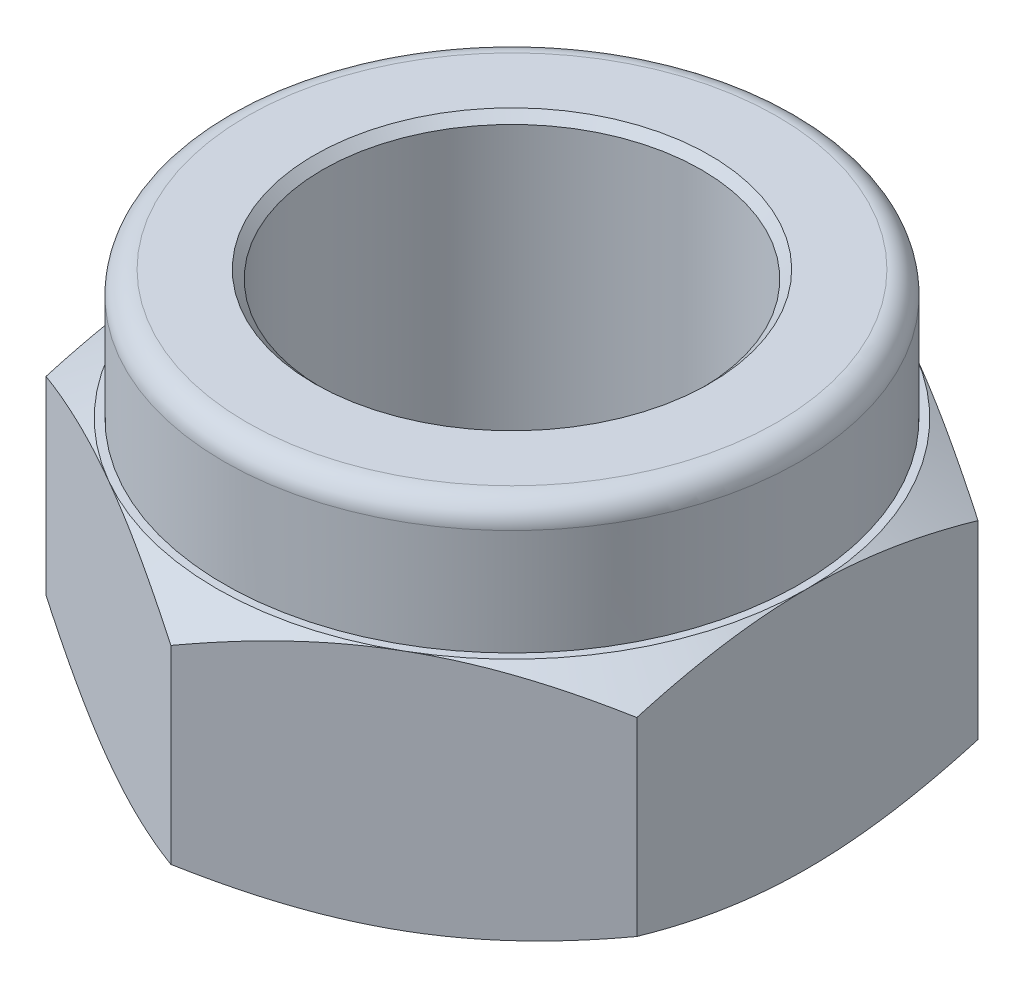
from build123d import *

# Parameters (mm, degrees)
EXTRUDE_START        = -3.2
EXTRUDE_1_DEPTH      = 3.2
SKETCH_2_3_OUTSIDE_W = 47.018
SKETCH_2_3_OUTSIDE_H = 48.224
SKETCH_2_3_OUTSIDE_R = 3.9
CUT_EXTRUDE_2_DEPTH  = 10
CUT_EXTRUDE_2_DRAFT  = -60
CUT_EXTRUDE_START    = -3.2
SKETCH_2_4_OUTSIDE_W = 53.646
SKETCH_2_4_OUTSIDE_H = 54.852
SKETCH_2_4_OUTSIDE_R = 3.9
CUT_EXTRUDE_3_DEPTH  = 11.91362431
CUT_EXTRUDE_3_DRAFT  = 60
FILLET_1_R           = 0.3
CHAMFER_2_SIZE       = 0.111


with BuildPart() as part:
    # 草图1 → 旋转1 (revolve)
    with BuildSketch(Plane.XY, mode=Mode.PRIVATE) as revolve_1_sk:
        Polygon((3.8, 4.9), (2.5, 4.9), (2.5, 0), (3.9, 0), (3.9, 3.2), (3.8, 3.2), align=None)
    revolve(revolve_1_sk.sketch.rotate(Axis((0, 0, 0), (0, 1, 0)), 90), axis=Axis((0, 0, 0), (0, 1, 0)))

    # 草图2 → 凸台-拉伸1 (add)
    with BuildSketch(Plane.XZ.offset(EXTRUDE_START)):
        with BuildLine():
            Line((1.950000027, 3.377499059), (0, 4.5033321))
            Line((0, 4.5033321), (-1.949999961, 3.377499097))
            ThreePointArc((-1.949999961, 3.377499097), (3.8e-08, 3.9), (1.950000027, 3.377499059))
        make_face()
        with BuildLine():
            ThreePointArc((-3.9, 0), (-3.377499063, 1.95000002), (-1.949999961, 3.377499097))
            Line((-1.949999961, 3.377499097), (-3.9, 2.25166605))
            Line((-3.9, 2.25166605), (-3.9, 0))
        make_face()
        with BuildLine():
            Line((3.9, 2.25166605), (1.950000027, 3.377499059))
            ThreePointArc((1.950000027, 3.377499059), (3.377499083, 1.949999986), (3.9, 0))
            Line((3.9, 0), (3.9, 2.25166605))
        make_face()
        with BuildLine():
            ThreePointArc((-1.950000108, -3.377499013), (-3.377499106, -1.949999946), (-3.9, 0))
            Line((-3.9, 0), (-3.9, -2.25166605))
            Line((-3.9, -2.25166605), (-1.950000108, -3.377499013))
        make_face()
        with BuildLine():
            Line((3.9, -2.25166605), (3.9, 0))
            ThreePointArc((3.9, 0), (3.377499044, -1.950000054), (1.949999892, -3.377499137))
            Line((1.949999892, -3.377499137), (3.9, -2.25166605))
        make_face()
        with BuildLine():
            ThreePointArc((1.949999892, -3.377499137), (-1.25e-07, -3.9), (-1.950000108, -3.377499013))
            Line((-1.950000108, -3.377499013), (0, -4.5033321))
            Line((0, -4.5033321), (1.949999892, -3.377499137))
        make_face()
    extrude(amount=EXTRUDE_1_DEPTH)


with BuildPart() as cut_extrude_2_tool:
    # 草图2<3> outside → 切除-拉伸2 (with draft: the straight prism first)
    with BuildSketch(Plane.XZ):
        Rectangle(SKETCH_2_3_OUTSIDE_W, SKETCH_2_3_OUTSIDE_H)
        Circle(SKETCH_2_3_OUTSIDE_R, mode=Mode.SUBTRACT)
    extrude(amount=-CUT_EXTRUDE_2_DEPTH)
    # 切除-拉伸2: the draft: its side faces are tilted about the plane it starts from
    cut_extrude_2_sides = [cut_extrude_2_tool.faces().sort_by_distance(p)[0] for p in [
        (0, 5, -24.112),
        (23.509, 5, 0),
        (0, 5, 24.112),
        (-23.509, 5, 0),
        (-3.9, 5, 0),
    ]]
    draft(cut_extrude_2_sides, Plane.XZ, CUT_EXTRUDE_2_DRAFT)


with BuildPart() as part_1:
    add(part.part)

    # 切除-拉伸2: cut by cut_extrude_2_tool
    add(cut_extrude_2_tool.part, mode=Mode.SUBTRACT)


with BuildPart() as cut_extrude_3_tool:
    # 草图2<4> outside → 切除-拉伸3 (with draft: the straight prism first)
    with BuildSketch(Plane.XZ.offset(CUT_EXTRUDE_START)):
        Rectangle(SKETCH_2_4_OUTSIDE_W, SKETCH_2_4_OUTSIDE_H)
        Circle(SKETCH_2_4_OUTSIDE_R, mode=Mode.SUBTRACT)
    extrude(amount=CUT_EXTRUDE_3_DEPTH)
    # 切除-拉伸3: the draft: its side faces are tilted about the plane it starts from
    cut_extrude_3_sides = [cut_extrude_3_tool.faces().sort_by_distance(p)[0] for p in [
        (0, -2.756812155, -27.426),
        (26.823, -2.756812155, 0),
        (0, -2.756812155, 27.426),
        (-26.823, -2.756812155, 0),
        (-3.9, -2.756812155, 0),
    ]]
    draft(cut_extrude_3_sides, Plane.XZ.offset(CUT_EXTRUDE_START), CUT_EXTRUDE_3_DRAFT)


with BuildPart() as part_2:
    add(part_1.part)

    # 切除-拉伸3: cut by cut_extrude_3_tool
    add(cut_extrude_3_tool.part, mode=Mode.SUBTRACT)

    # 圆角1
    fillet_1_edges = [part_2.edges().sort_by_distance(p)[0] for p in [
        (0, 4.9, 3.8),
    ]]
    fillet(fillet_1_edges, radius=FILLET_1_R)

    # 倒角2
    chamfer_2_edges = [part_2.edges().sort_by_distance(p)[0] for p in [
        (0, 0, 2.5),
        (0, 4.9, 2.5),
    ]]
    chamfer(chamfer_2_edges, length=CHAMFER_2_SIZE)


solid = part_2.part
